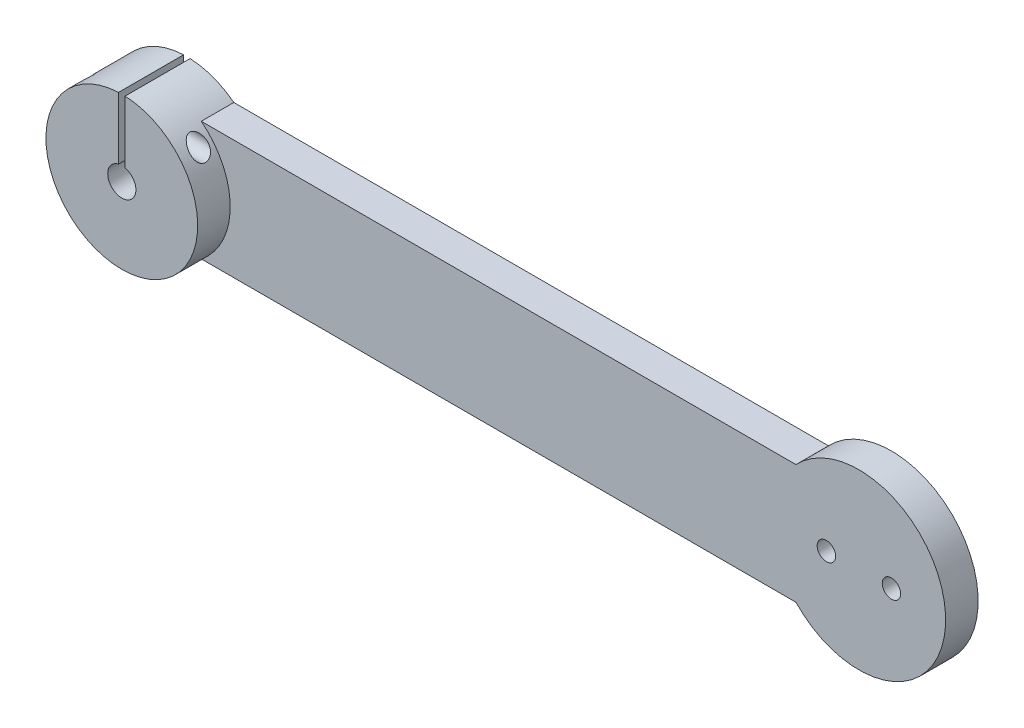
from build123d import *

# Parameters (mm, degrees)
SKETCH_1_W                         = 130
SKETCH_1_H                         = 22
ARM_WEB_L130_W22_T6_DEPTH          = 6
SKETCH_2_R                         = 14
SPLIT_CLAMP_HUB_DEPTH              = 12
SKETCH_3_R                         = 16
WRIST_END_R16_DEPTH                = 6
SHAFT_D5P2_AND_WRIST_M3_DEPTH      = 148.363496158
SHAFT_D5P2_AND_WRIST_M3_DEPTH_BACK = 148.363496158
SKETCH_4_R                         = 2.6
SKETCH_4_R_2                       = 1.7
CLAMP_SPLIT_1P2_DEPTH              = 148.363496158
CLAMP_SPLIT_1P2_DEPTH_BACK         = 148.363496158
SKETCH_5_W                         = 1.2
SKETCH_5_H                         = 12.8
CLAMP_CROSSBOLT_M3_DEPTH           = 148.363496158
CLAMP_CROSSBOLT_M3_DEPTH_BACK      = 148.363496158
SKETCH_6_R                         = 1.7


with BuildPart() as part:
    # 草图1 → Arm_web_L130_W22_T6 (new body)
    with BuildSketch(Plane.XY):
        with Locations((65, 0)):
            Rectangle(SKETCH_1_W, SKETCH_1_H)
    extrude(amount=ARM_WEB_L130_W22_T6_DEPTH)

    # 草图2 → Split_clamp_hub (add)
    with BuildSketch(Plane.XY):
        with Locations(Location((0, 0, 0), (0, 0, 308.213210702))):
            Circle(SKETCH_2_R)
    extrude(amount=SPLIT_CLAMP_HUB_DEPTH)

    # 草图3 → Wrist_end_R16 (add)
    with BuildSketch(Plane.XY):
        with Locations((130, 0)):
            Circle(SKETCH_3_R)
    extrude(amount=WRIST_END_R16_DEPTH)

    # 草图4 → Shaft_D5p2_and_wrist_M3 (cut, two sides: drawn at the far end of the back side and taken through both)
    with BuildSketch(Plane.XY.offset(-SHAFT_D5P2_AND_WRIST_M3_DEPTH_BACK)):
        Circle(SKETCH_4_R)
        with Locations((124, 0)):
            Circle(SKETCH_4_R_2)
        with Locations((136, 0)):
            Circle(SKETCH_4_R_2)
    extrude(amount=SHAFT_D5P2_AND_WRIST_M3_DEPTH + SHAFT_D5P2_AND_WRIST_M3_DEPTH_BACK, mode=Mode.SUBTRACT)

    # 草图5 → Clamp_split_1p2 (cut, two sides: drawn at the far end of the back side and taken through both)
    with BuildSketch(Plane.XY.offset(-CLAMP_SPLIT_1P2_DEPTH_BACK)):
        with Locations((0, 8.6)):
            Rectangle(SKETCH_5_W, SKETCH_5_H)
    extrude(amount=CLAMP_SPLIT_1P2_DEPTH + CLAMP_SPLIT_1P2_DEPTH_BACK, mode=Mode.SUBTRACT)

    # 草图6 → Clamp_crossbolt_M3 (cut, two sides: drawn at the far end of the back side and taken through both)
    with BuildSketch(Plane(origin=(0, 0, 0), x_dir=(0, 0, -1), z_dir=(1, 0, 0)).offset(-CLAMP_CROSSBOLT_M3_DEPTH_BACK)):
        with Locations((-8.5, 9)):
            Circle(SKETCH_6_R)
    extrude(amount=CLAMP_CROSSBOLT_M3_DEPTH + CLAMP_CROSSBOLT_M3_DEPTH_BACK, mode=Mode.SUBTRACT)


solid = part.part
